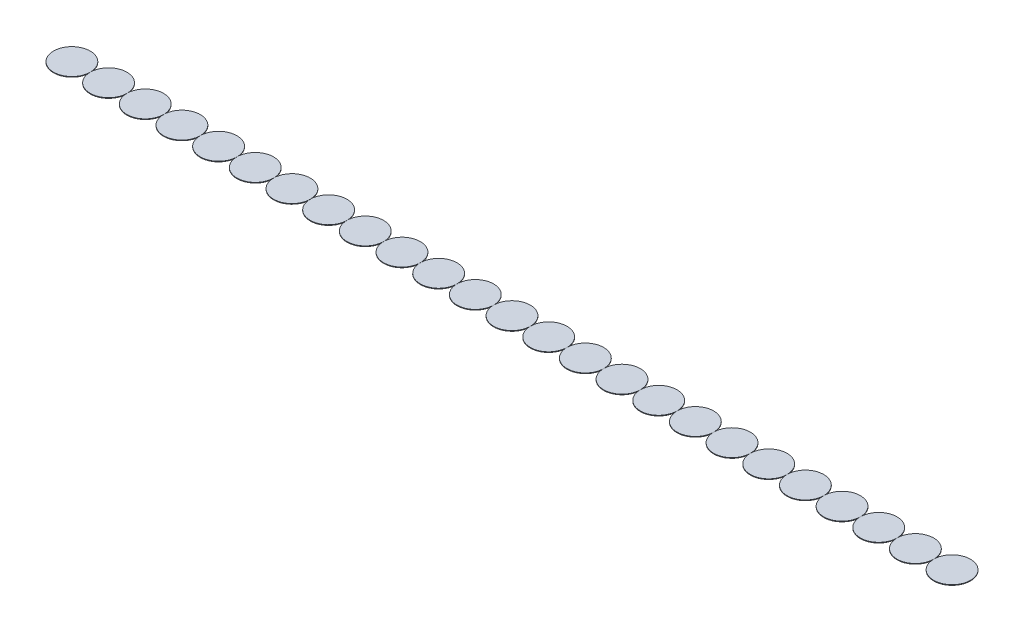
from build123d import *

# Parameters (mm, degrees)
SKETCH1_R              = 31
BOSS_EXTRUDE1_DEPTH    = 1
BOSS_EXTRUDE1_2_DEPTH  = 1
BOSS_EXTRUDE1_3_DEPTH  = 1
BOSS_EXTRUDE1_4_DEPTH  = 1
BOSS_EXTRUDE1_5_DEPTH  = 1
BOSS_EXTRUDE1_6_DEPTH  = 1
BOSS_EXTRUDE1_7_DEPTH  = 1
BOSS_EXTRUDE1_8_DEPTH  = 1
BOSS_EXTRUDE1_9_DEPTH  = 1
BOSS_EXTRUDE1_10_DEPTH = 1
BOSS_EXTRUDE1_11_DEPTH = 1
BOSS_EXTRUDE1_12_DEPTH = 1
BOSS_EXTRUDE1_13_DEPTH = 1
BOSS_EXTRUDE1_14_DEPTH = 1
BOSS_EXTRUDE1_15_DEPTH = 1
BOSS_EXTRUDE1_16_DEPTH = 1
BOSS_EXTRUDE1_17_DEPTH = 1
BOSS_EXTRUDE1_18_DEPTH = 1
BOSS_EXTRUDE1_19_DEPTH = 1
BOSS_EXTRUDE1_20_DEPTH = 1
BOSS_EXTRUDE1_21_DEPTH = 1
BOSS_EXTRUDE1_22_DEPTH = 1
BOSS_EXTRUDE1_23_DEPTH = 1
BOSS_EXTRUDE1_24_DEPTH = 1
BOSS_EXTRUDE1_25_DEPTH = 1


with BuildPart() as part:
    # Sketch1 → Boss-Extrude1 (new body)
    with BuildSketch(Plane(origin=(0, 0, 0), x_dir=(1, 0, 0), z_dir=(0, 1, 0))):
        with Locations(Location((0, 0, 0), (0, 0, 270))):
            Circle(SKETCH1_R)
    extrude(amount=BOSS_EXTRUDE1_DEPTH)


with BuildPart() as body_2:
    # Sketch1 → Boss-Extrude1 2 (new body)
    with BuildSketch(Plane(origin=(0, 0, 0), x_dir=(1, 0, 0), z_dir=(0, 1, 0))):
        with Locations(Location((62, 0, 0), (0, 0, 270))):
            Circle(SKETCH1_R)
    extrude(amount=BOSS_EXTRUDE1_2_DEPTH)


with BuildPart() as body_3:
    # Sketch1 → Boss-Extrude1 3 (new body)
    with BuildSketch(Plane(origin=(0, 0, 0), x_dir=(1, 0, 0), z_dir=(0, 1, 0))):
        with Locations(Location((124, 0, 0), (0, 0, 270))):
            Circle(SKETCH1_R)
    extrude(amount=BOSS_EXTRUDE1_3_DEPTH)


with BuildPart() as body_4:
    # Sketch1 → Boss-Extrude1 4 (new body)
    with BuildSketch(Plane(origin=(0, 0, 0), x_dir=(1, 0, 0), z_dir=(0, 1, 0))):
        with Locations(Location((186, 0, 0), (0, 0, 270))):
            Circle(SKETCH1_R)
    extrude(amount=BOSS_EXTRUDE1_4_DEPTH)


with BuildPart() as body_5:
    # Sketch1 → Boss-Extrude1 5 (new body)
    with BuildSketch(Plane(origin=(0, 0, 0), x_dir=(1, 0, 0), z_dir=(0, 1, 0))):
        with Locations(Location((248, 0, 0), (0, 0, 270))):
            Circle(SKETCH1_R)
    extrude(amount=BOSS_EXTRUDE1_5_DEPTH)


with BuildPart() as body_6:
    # Sketch1 → Boss-Extrude1 6 (new body)
    with BuildSketch(Plane(origin=(0, 0, 0), x_dir=(1, 0, 0), z_dir=(0, 1, 0))):
        with Locations(Location((310, 0, 0), (0, 0, 270))):
            Circle(SKETCH1_R)
    extrude(amount=BOSS_EXTRUDE1_6_DEPTH)


with BuildPart() as body_7:
    # Sketch1 → Boss-Extrude1 7 (new body)
    with BuildSketch(Plane(origin=(0, 0, 0), x_dir=(1, 0, 0), z_dir=(0, 1, 0))):
        with Locations(Location((372, 0, 0), (0, 0, 270))):
            Circle(SKETCH1_R)
    extrude(amount=BOSS_EXTRUDE1_7_DEPTH)


with BuildPart() as body_8:
    # Sketch1 → Boss-Extrude1 8 (new body)
    with BuildSketch(Plane(origin=(0, 0, 0), x_dir=(1, 0, 0), z_dir=(0, 1, 0))):
        with Locations(Location((434, 0, 0), (0, 0, 270))):
            Circle(SKETCH1_R)
    extrude(amount=BOSS_EXTRUDE1_8_DEPTH)


with BuildPart() as body_9:
    # Sketch1 → Boss-Extrude1 9 (new body)
    with BuildSketch(Plane(origin=(0, 0, 0), x_dir=(1, 0, 0), z_dir=(0, 1, 0))):
        with Locations(Location((496, 0, 0), (0, 0, 270))):
            Circle(SKETCH1_R)
    extrude(amount=BOSS_EXTRUDE1_9_DEPTH)


with BuildPart() as body_10:
    # Sketch1 → Boss-Extrude1 10 (new body)
    with BuildSketch(Plane(origin=(0, 0, 0), x_dir=(1, 0, 0), z_dir=(0, 1, 0))):
        with Locations(Location((558, 0, 0), (0, 0, 270))):
            Circle(SKETCH1_R)
    extrude(amount=BOSS_EXTRUDE1_10_DEPTH)


with BuildPart() as body_11:
    # Sketch1 → Boss-Extrude1 11 (new body)
    with BuildSketch(Plane(origin=(0, 0, 0), x_dir=(1, 0, 0), z_dir=(0, 1, 0))):
        with Locations(Location((620, 0, 0), (0, 0, 270))):
            Circle(SKETCH1_R)
    extrude(amount=BOSS_EXTRUDE1_11_DEPTH)


with BuildPart() as body_12:
    # Sketch1 → Boss-Extrude1 12 (new body)
    with BuildSketch(Plane(origin=(0, 0, 0), x_dir=(1, 0, 0), z_dir=(0, 1, 0))):
        with Locations(Location((682, 0, 0), (0, 0, 270))):
            Circle(SKETCH1_R)
    extrude(amount=BOSS_EXTRUDE1_12_DEPTH)


with BuildPart() as body_13:
    # Sketch1 → Boss-Extrude1 13 (new body)
    with BuildSketch(Plane(origin=(0, 0, 0), x_dir=(1, 0, 0), z_dir=(0, 1, 0))):
        with Locations(Location((744, 0, 0), (0, 0, 270))):
            Circle(SKETCH1_R)
    extrude(amount=BOSS_EXTRUDE1_13_DEPTH)


with BuildPart() as body_14:
    # Sketch1 → Boss-Extrude1 14 (new body)
    with BuildSketch(Plane(origin=(0, 0, 0), x_dir=(1, 0, 0), z_dir=(0, 1, 0))):
        with Locations(Location((806, 0, 0), (0, 0, 270))):
            Circle(SKETCH1_R)
    extrude(amount=BOSS_EXTRUDE1_14_DEPTH)


with BuildPart() as body_15:
    # Sketch1 → Boss-Extrude1 15 (new body)
    with BuildSketch(Plane(origin=(0, 0, 0), x_dir=(1, 0, 0), z_dir=(0, 1, 0))):
        with Locations(Location((868, 0, 0), (0, 0, 270))):
            Circle(SKETCH1_R)
    extrude(amount=BOSS_EXTRUDE1_15_DEPTH)


with BuildPart() as body_16:
    # Sketch1 → Boss-Extrude1 16 (new body)
    with BuildSketch(Plane(origin=(0, 0, 0), x_dir=(1, 0, 0), z_dir=(0, 1, 0))):
        with Locations(Location((930, 0, 0), (0, 0, 270))):
            Circle(SKETCH1_R)
    extrude(amount=BOSS_EXTRUDE1_16_DEPTH)


with BuildPart() as body_17:
    # Sketch1 → Boss-Extrude1 17 (new body)
    with BuildSketch(Plane(origin=(0, 0, 0), x_dir=(1, 0, 0), z_dir=(0, 1, 0))):
        with Locations(Location((992, 0, 0), (0, 0, 270))):
            Circle(SKETCH1_R)
    extrude(amount=BOSS_EXTRUDE1_17_DEPTH)


with BuildPart() as body_18:
    # Sketch1 → Boss-Extrude1 18 (new body)
    with BuildSketch(Plane(origin=(0, 0, 0), x_dir=(1, 0, 0), z_dir=(0, 1, 0))):
        with Locations(Location((1054, 0, 0), (0, 0, 270))):
            Circle(SKETCH1_R)
    extrude(amount=BOSS_EXTRUDE1_18_DEPTH)


with BuildPart() as body_19:
    # Sketch1 → Boss-Extrude1 19 (new body)
    with BuildSketch(Plane(origin=(0, 0, 0), x_dir=(1, 0, 0), z_dir=(0, 1, 0))):
        with Locations(Location((1116, 0, 0), (0, 0, 270))):
            Circle(SKETCH1_R)
    extrude(amount=BOSS_EXTRUDE1_19_DEPTH)


with BuildPart() as body_20:
    # Sketch1 → Boss-Extrude1 20 (new body)
    with BuildSketch(Plane(origin=(0, 0, 0), x_dir=(1, 0, 0), z_dir=(0, 1, 0))):
        with Locations(Location((1178, 0, 0), (0, 0, 270))):
            Circle(SKETCH1_R)
    extrude(amount=BOSS_EXTRUDE1_20_DEPTH)


with BuildPart() as body_21:
    # Sketch1 → Boss-Extrude1 21 (new body)
    with BuildSketch(Plane(origin=(0, 0, 0), x_dir=(1, 0, 0), z_dir=(0, 1, 0))):
        with Locations(Location((1240, 0, 0), (0, 0, 270))):
            Circle(SKETCH1_R)
    extrude(amount=BOSS_EXTRUDE1_21_DEPTH)


with BuildPart() as body_22:
    # Sketch1 → Boss-Extrude1 22 (new body)
    with BuildSketch(Plane(origin=(0, 0, 0), x_dir=(1, 0, 0), z_dir=(0, 1, 0))):
        with Locations(Location((1302, 0, 0), (0, 0, 270))):
            Circle(SKETCH1_R)
    extrude(amount=BOSS_EXTRUDE1_22_DEPTH)


with BuildPart() as body_23:
    # Sketch1 → Boss-Extrude1 23 (new body)
    with BuildSketch(Plane(origin=(0, 0, 0), x_dir=(1, 0, 0), z_dir=(0, 1, 0))):
        with Locations(Location((1364, 0, 0), (0, 0, 270))):
            Circle(SKETCH1_R)
    extrude(amount=BOSS_EXTRUDE1_23_DEPTH)


with BuildPart() as body_24:
    # Sketch1 → Boss-Extrude1 24 (new body)
    with BuildSketch(Plane(origin=(0, 0, 0), x_dir=(1, 0, 0), z_dir=(0, 1, 0))):
        with Locations(Location((1426, 0, 0), (0, 0, 270))):
            Circle(SKETCH1_R)
    extrude(amount=BOSS_EXTRUDE1_24_DEPTH)


with BuildPart() as body_25:
    # Sketch1 → Boss-Extrude1 25 (new body)
    with BuildSketch(Plane(origin=(0, 0, 0), x_dir=(1, 0, 0), z_dir=(0, 1, 0))):
        with Locations(Location((1488, 0, 0), (0, 0, 270))):
            Circle(SKETCH1_R)
    extrude(amount=BOSS_EXTRUDE1_25_DEPTH)


solid = Compound([part.part, body_2.part, body_3.part, body_4.part, body_5.part, body_6.part, body_7.part, body_8.part, body_9.part, body_10.part, body_11.part, body_12.part, body_13.part, body_14.part, body_15.part, body_16.part, body_17.part, body_18.part, body_19.part, body_20.part, body_21.part, body_22.part, body_23.part, body_24.part, body_25.part])
